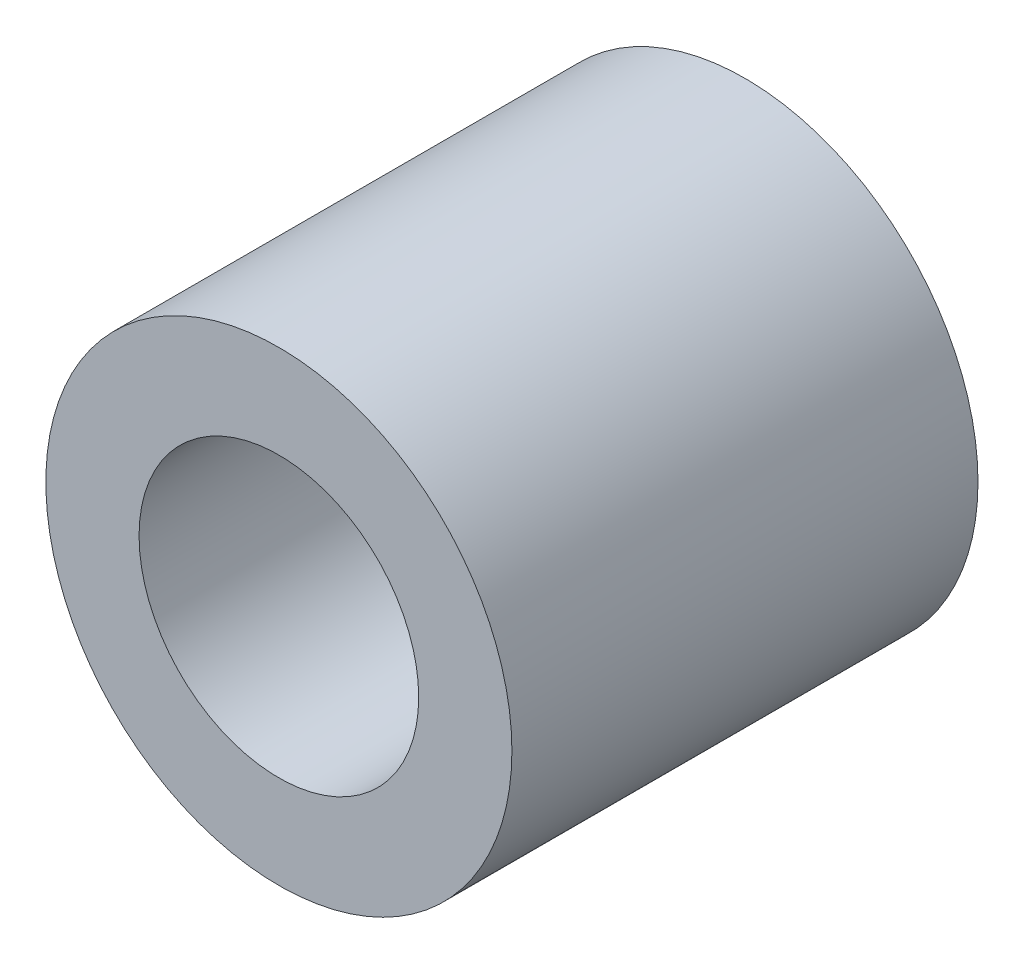
from build123d import *

# Parameters (mm, degrees)
ESBO_O1_R                = 5
ESBO_O1_R_2              = 3
RESSALTO_EXTRUS_O1_DEPTH = 10


with BuildPart() as part:
    # Esboço1 → Ressalto-extrusão1 (new body)
    with BuildSketch(Plane.XY):
        Circle(ESBO_O1_R)
        Circle(ESBO_O1_R_2, mode=Mode.SUBTRACT)
    extrude(amount=RESSALTO_EXTRUS_O1_DEPTH)


solid = part.part
